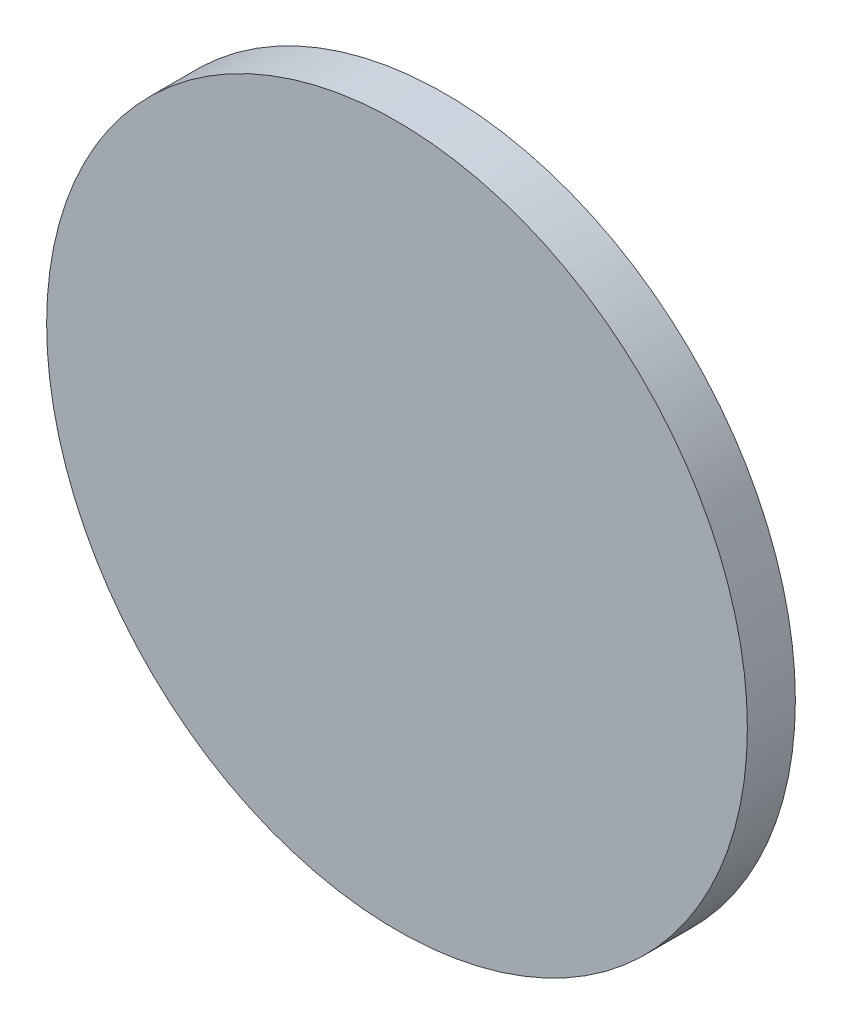
from build123d import *

# Parameters (mm, degrees)
SKETCH1_R           = 11.675
BOSS_EXTRUDE1_DEPTH = 0.8


with BuildPart() as part:
    # Sketch1 → Boss-Extrude1 (new, symmetric)
    with BuildSketch(Plane.XY):
        Circle(SKETCH1_R)
    extrude(amount=BOSS_EXTRUDE1_DEPTH, both=True)


solid = part.part
